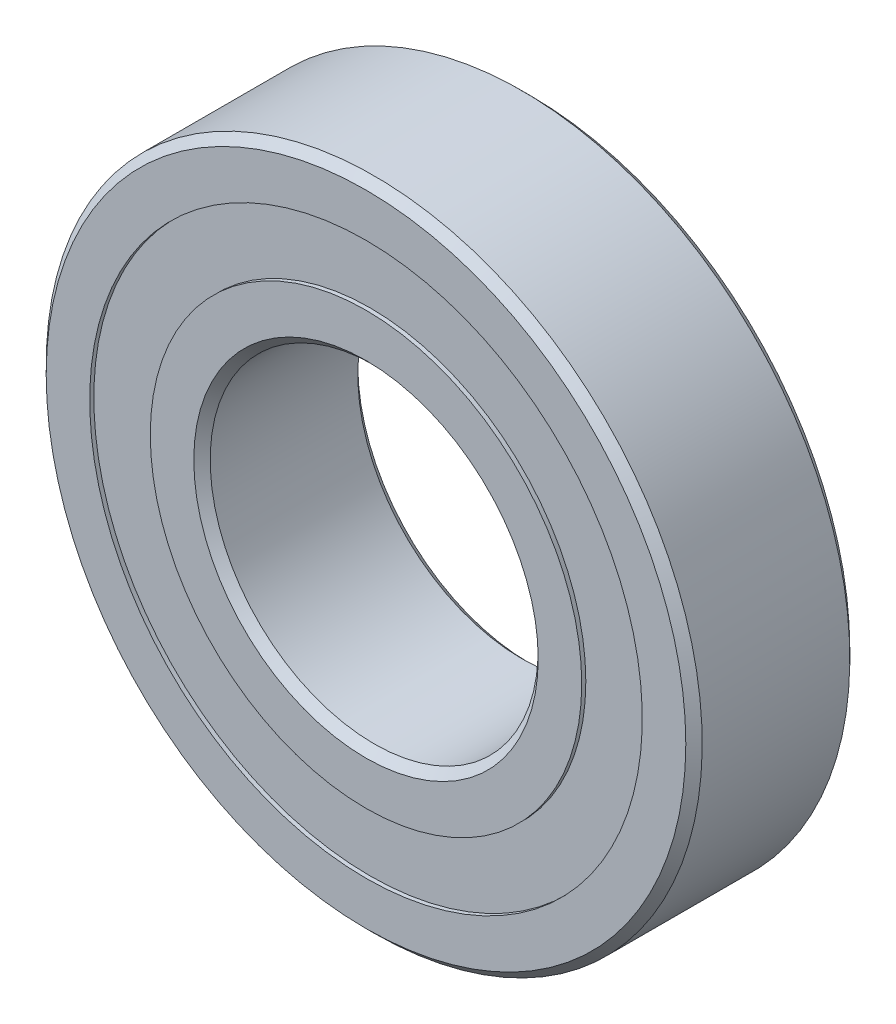
from build123d import *

# Parameters (mm, degrees)
CIRPATTERN1_COUNT = 12
SKETCH6_W         = 2.363418429
SKETCH6_H         = 4.68923077


with BuildPart() as part:
    # Sketch3 → Revolve1 (revolve)
    with BuildSketch(Plane(origin=(0, 0, 0), x_dir=(0, 0, -1), z_dir=(1, 0, 0)), mode=Mode.PRIVATE) as revolve1_sk:
        with BuildLine():
            Line((5.715, 25.4), (6.35, 24.765))
            Line((6.35, 24.765), (6.35, 21.394615385))
            Line((6.35, 21.394615385), (2.822222222, 21.394615385))
            ThreePointArc((2.822222222, 21.394615385), (0, 22.719081571), (-2.822222222, 21.394615385))
            Line((-2.822222222, 21.394615385), (-6.35, 21.394615385))
            Line((-6.35, 21.394615385), (-6.35, 24.765))
            Line((-6.35, 24.765), (-5.715, 25.4))
            Line((-5.715, 25.4), (5.715, 25.4))
        make_face()
    revolve(revolve1_sk.sketch.rotate(Axis((0, 0, 6.35), (0, 0, -1)), 180), axis=Axis((0, 0, 6.35), (0, 0, -1)))


with BuildPart() as body_2:
    # Sketch4 → Revolve2 (revolve)
    with BuildSketch(Plane(origin=(0, 0, 0), x_dir=(0, 0, -1), z_dir=(1, 0, 0)), mode=Mode.PRIVATE) as revolve2_sk:
        with BuildLine():
            Line((-5.715, 12.7), (-6.35, 13.335))
            Line((-6.35, 13.335), (-6.35, 16.705384615))
            Line((-6.35, 16.705384615), (-2.822222222, 16.705384615))
            ThreePointArc((-2.822222222, 16.705384615), (0, 15.380918429), (2.822222222, 16.705384615))
            Line((2.822222222, 16.705384615), (6.35, 16.705384615))
            Line((6.35, 16.705384615), (6.35, 13.335))
            Line((6.35, 13.335), (5.715, 12.7))
            Line((5.715, 12.7), (-5.715, 12.7))
        make_face()
    revolve(revolve2_sk.sketch.rotate(Axis((0, 0, 6.35), (0, 0, -1)), 180), axis=Axis((0, 0, 6.35), (0, 0, -1)))


with BuildPart() as body_3:
    # Sketch5 → Revolve3 (revolve)
    with BuildSketch(Plane(origin=(0, 0, 0), x_dir=(0, 0, -1), z_dir=(1, 0, 0))):
        with BuildLine():
            Line((-3.669081571, 19.05), (3.669081571, 19.05))
            ThreePointArc((3.669081571, 19.05), (0, 22.719081571), (-3.669081571, 19.05))
        make_face()
    revolve(axis=Axis((0, 19.05, 3.669081571), (0, 0, -1)))


with BuildPart() as cirpattern1_1:
    # CirPattern1: pattern copy
    add(body_3.part.rotate(Axis((0, 0, 0), (0, 0, 1)), 1 * 360 / CIRPATTERN1_COUNT))


with BuildPart() as cirpattern1_2:
    # CirPattern1: pattern copy
    add(body_3.part.rotate(Axis((0, 0, 0), (0, 0, 1)), 2 * 360 / CIRPATTERN1_COUNT))


with BuildPart() as cirpattern1_3:
    # CirPattern1: pattern copy
    add(body_3.part.rotate(Axis((0, 0, 0), (0, 0, 1)), 3 * 360 / CIRPATTERN1_COUNT))


with BuildPart() as cirpattern1_4:
    # CirPattern1: pattern copy
    add(body_3.part.rotate(Axis((0, 0, 0), (0, 0, 1)), 4 * 360 / CIRPATTERN1_COUNT))


with BuildPart() as cirpattern1_5:
    # CirPattern1: pattern copy
    add(body_3.part.rotate(Axis((0, 0, 0), (0, 0, 1)), 5 * 360 / CIRPATTERN1_COUNT))


with BuildPart() as cirpattern1_6:
    # CirPattern1: pattern copy
    add(body_3.part.rotate(Axis((0, 0, 0), (0, 0, 1)), 6 * 360 / CIRPATTERN1_COUNT))


with BuildPart() as cirpattern1_7:
    # CirPattern1: pattern copy
    add(body_3.part.rotate(Axis((0, 0, 0), (0, 0, 1)), 7 * 360 / CIRPATTERN1_COUNT))


with BuildPart() as cirpattern1_8:
    # CirPattern1: pattern copy
    add(body_3.part.rotate(Axis((0, 0, 0), (0, 0, 1)), 8 * 360 / CIRPATTERN1_COUNT))


with BuildPart() as cirpattern1_9:
    # CirPattern1: pattern copy
    add(body_3.part.rotate(Axis((0, 0, 0), (0, 0, 1)), 9 * 360 / CIRPATTERN1_COUNT))


with BuildPart() as cirpattern1_10:
    # CirPattern1: pattern copy
    add(body_3.part.rotate(Axis((0, 0, 0), (0, 0, 1)), 10 * 360 / CIRPATTERN1_COUNT))


with BuildPart() as cirpattern1_11:
    # CirPattern1: pattern copy
    add(body_3.part.rotate(Axis((0, 0, 0), (0, 0, 1)), 11 * 360 / CIRPATTERN1_COUNT))


with BuildPart() as body_15:
    # Sketch6 → Revolve4 (revolve)
    with BuildSketch(Plane(origin=(0, 0, 0), x_dir=(0, 0, -1), z_dir=(1, 0, 0)), mode=Mode.PRIVATE) as revolve4_sk:
        with Locations((-4.850790786, 19.05)):
            Rectangle(SKETCH6_W, SKETCH6_H)
        with Locations((4.850790786, 19.05)):
            Rectangle(SKETCH6_W, SKETCH6_H)
    revolve(revolve4_sk.sketch.rotate(Axis((0, 0, 6.35), (0, 0, -1)), 180), axis=Axis((0, 0, 6.35), (0, 0, -1)))


solid = Compound([part.part, body_2.part, body_3.part, cirpattern1_1.part, cirpattern1_2.part, cirpattern1_3.part, cirpattern1_4.part, cirpattern1_5.part, cirpattern1_6.part, cirpattern1_7.part, cirpattern1_8.part, cirpattern1_9.part, cirpattern1_10.part, cirpattern1_11.part, body_15.part])
